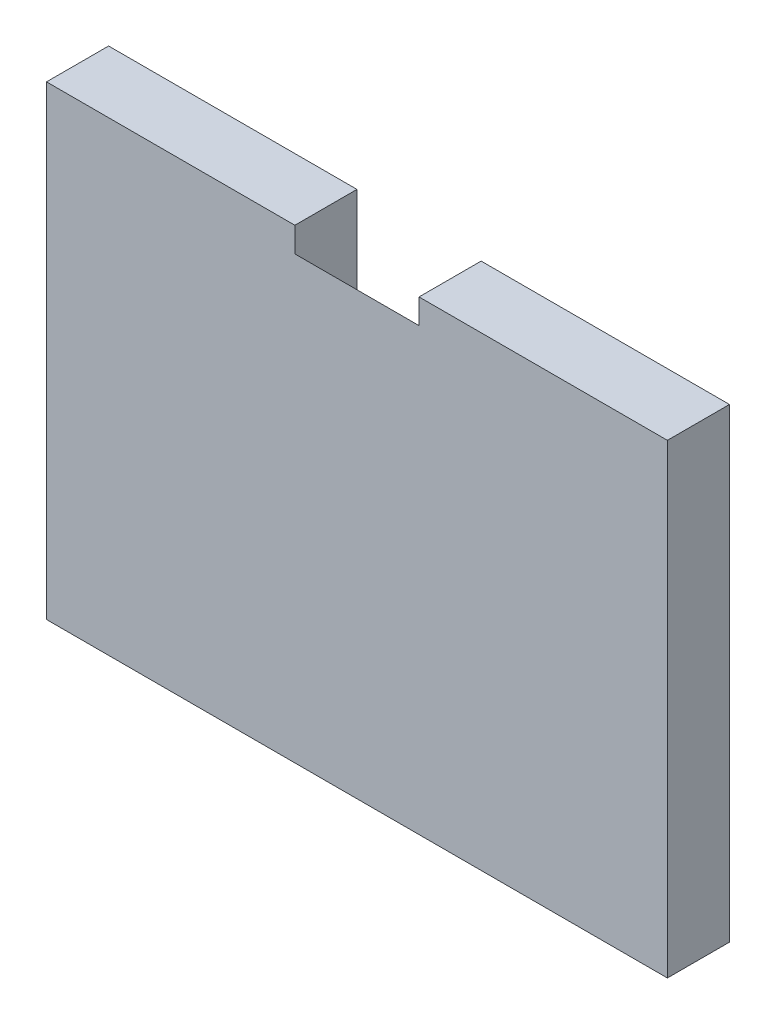
from build123d import *

# Parameters (mm, degrees)
BOSS_EXTRU_1_DEPTH      = 10
ENL_V_MAT_EXTRU_4_DEPTH = 60
BOSS_EXTRU_2_DEPTH      = 40


with BuildPart() as part:
    # Esquisse1 → Boss.-Extru.1 (new body)
    with BuildSketch(Plane.XY):
        Polygon((-50, -37.5), (50, -37.5), (50, 37.5), (10, 37.5), (10, 33.5), (-10, 33.5), (-10, 37.5), (-50, 37.5), align=None)
    extrude(amount=BOSS_EXTRU_1_DEPTH)

    # Esquisse4 → Enlèv. mat.-Extru.4 (cut)
    with BuildSketch(Plane(origin=(50, 0, 0), x_dir=(0, 0, -1), z_dir=(1, 0, 0))):
        Polygon((-10, 33.5), (0, 23.5), (0, 33.5), align=None)
    extrude(amount=-ENL_V_MAT_EXTRU_4_DEPTH, mode=Mode.SUBTRACT)


with BuildPart() as enl_v_mat_extru_4_piece_1:
    # of the separate pieces the step leaves, piece 1, a body of its own (enl_v_mat_extru_4_pieces)
    add(part.part.solids().sort_by_distance((-50, -37.5, 0))[0])



with BuildPart() as enl_v_mat_extru_4_piece_2:
    # of the separate pieces the step leaves, piece 2, a body of its own (enl_v_mat_extru_4_pieces)
    add(part.part.solids().sort_by_distance((10, 37.5, 10))[0])


with BuildPart() as enl_v_mat_extru_4_piece_1_1:
    add(enl_v_mat_extru_4_piece_1.part)

    add(enl_v_mat_extru_4_piece_2.part)  # Boss.-Extru.2 merges Enlèv. mat.-Extru.4 piece 2
    # Esquisse11 → Boss.-Extru.2 (add)
    with BuildSketch(Plane(origin=(50, 0, 0), x_dir=(0, 0, -1), z_dir=(1, 0, 0))):
        Polygon((-10, 33.5), (0, 33.5), (0, 23.5), align=None)
    extrude(amount=-BOSS_EXTRU_2_DEPTH)


solid = enl_v_mat_extru_4_piece_1_1.part
